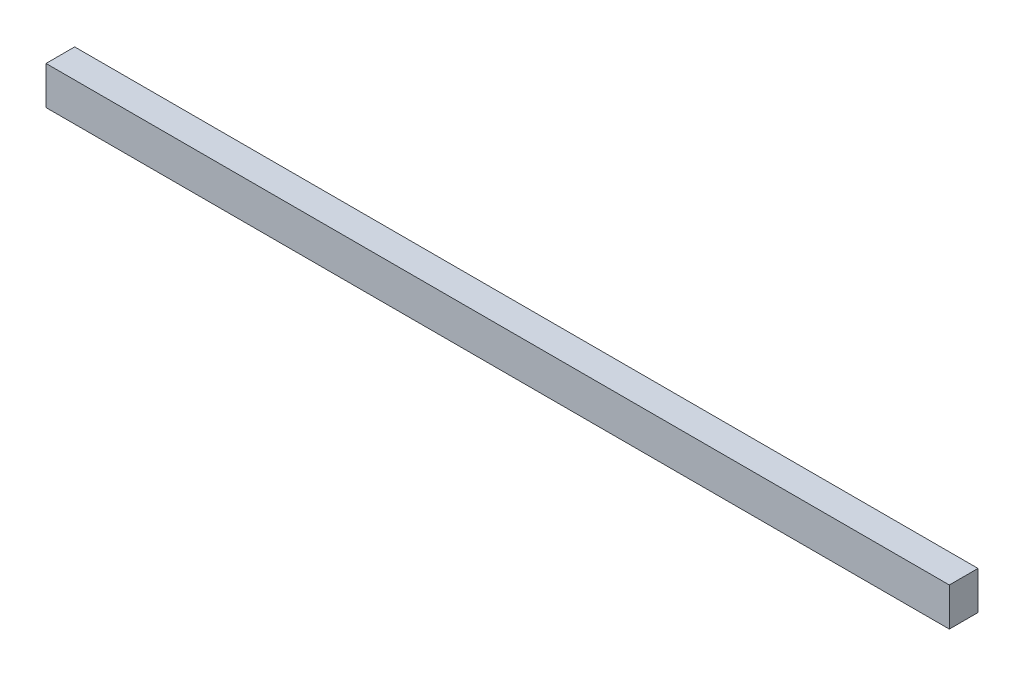
from build123d import *

# Parameters (mm, degrees)
SKETCH1_W           = 2400.3
SKETCH1_H           = 101.6
BOSS_EXTRUDE1_DEPTH = 38.1


with BuildPart() as part:
    # Sketch1 → Boss-Extrude1 (new, symmetric)
    with BuildSketch(Plane.XY):
        Rectangle(SKETCH1_W, SKETCH1_H)
    extrude(amount=BOSS_EXTRUDE1_DEPTH, both=True)


solid = part.part
